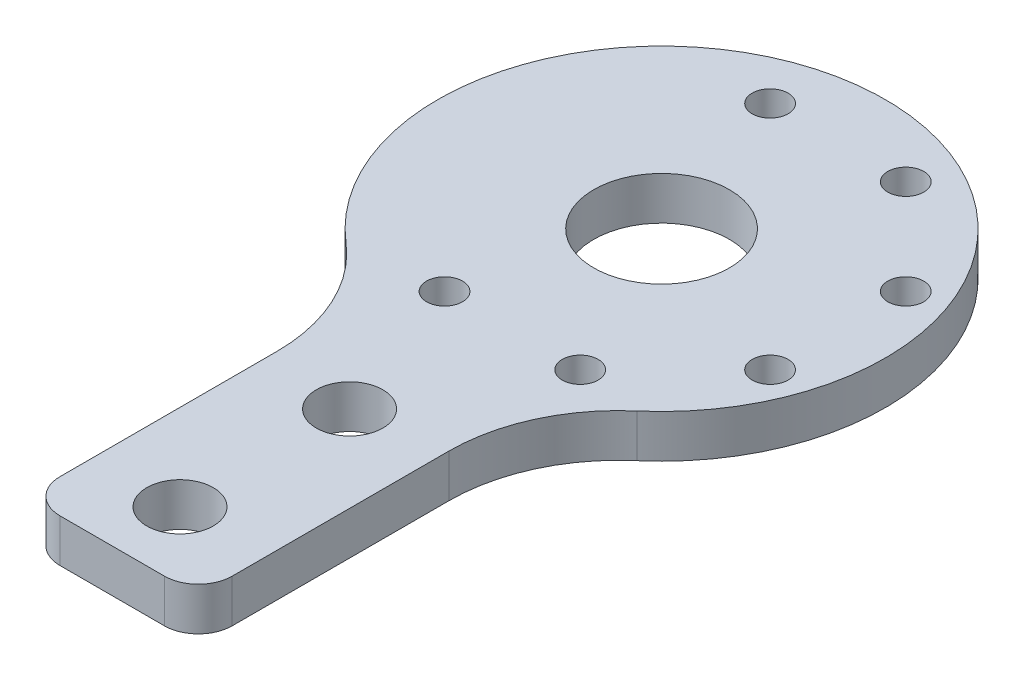
from build123d import *

# Parameters (mm, degrees)
BOSS_EXTRUDE1_DEPTH     = 6.35
SKETCH5_R               = 10
CUT_EXTRUDE1_DEPTH      = 88.694483863
F_3_8_CLEARANCE_HOLE1_D = 9.8044
FILLET1_R               = 25
M5_CLEARANCE_HOLE1_D    = 5.3
FILLET2_R               = 5


with BuildPart() as part:
    # Sketch1 → Boss-Extrude1 (new body)
    with BuildSketch(Plane(origin=(0, 0, 0), x_dir=(1, 0, 0), z_dir=(0, 1, 0))):
        with BuildLine():
            Line((-12.7, -81), (12.7, -81))
            Line((12.7, -81), (12.7, -30.458332193))
            ThreePointArc((12.7, -30.458332193), (0, 33), (-12.7, -30.458332193))
            Line((-12.7, -30.458332193), (-12.7, -81))
        make_face()
    extrude(amount=BOSS_EXTRUDE1_DEPTH)

    # Sketch5 → Cut-Extrude1 (cut, through all)
    with BuildSketch(Plane.XZ):
        with Locations(Location((0, 0, 0), (0, 0, 270))):
            Circle(SKETCH5_R)
    extrude(amount=-CUT_EXTRUDE1_DEPTH, mode=Mode.SUBTRACT)

    # 3/8 Clearance Hole1 (through all)
    with Locations(Plane(origin=(0, 0, 0), x_dir=(-1, 0, 0), z_dir=(0, -1, 0))):
        with Locations((0, -46), (0, -71)):
            Hole(F_3_8_CLEARANCE_HOLE1_D / 2)

    # Fillet1
    fillet1_edges = [part.edges().sort_by_distance(p)[0] for p in [
        (-12.7, 3.175, 30.458332193),
        (12.7, 3.175, 30.458332193),
    ]]
    fillet(fillet1_edges, radius=FILLET1_R)

    # M5 Clearance Hole1 (through all)
    with Locations(Plane(origin=(0, 0, 0), x_dir=(-1, 0, 0), z_dir=(0, -1, 0))):
        with Locations((8, 24), (-12, 24), (-26, 10), (-26, -10), (-12, -24), (8, -24)):
            Hole(M5_CLEARANCE_HOLE1_D / 2)

    # Fillet2
    fillet2_edges = [part.edges().sort_by_distance(p)[0] for p in [
        (12.7, 3.175, 81),
        (-12.7, 3.175, 81),
    ]]
    fillet(fillet2_edges, radius=FILLET2_R)


solid = part.part
